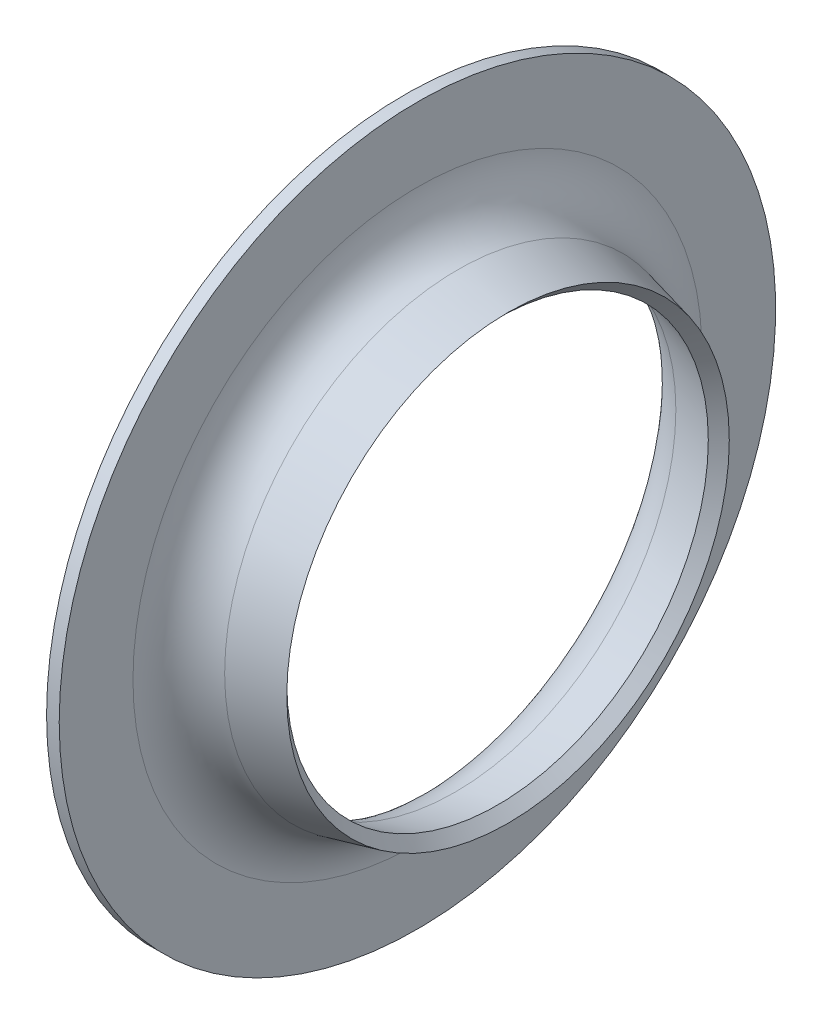
from build123d import *


with BuildPart() as part:
    # 草图1 → 旋转1 (revolve)
    with BuildSketch(Plane.XY, mode=Mode.PRIVATE) as revolve_1_sk:
        with BuildLine():
            Line((-4.3, 17), (-4.3, 13.5))
            ThreePointArc((-4.3, 13.5), (-3.762314929, 11.951026107), (-2.380543903, 11.068340325))
            Line((-2.380543903, 11.068340325), (0, 10.5))
            Line((0, 10.5), (-0.49797431, 10.00202569))
            Line((-0.49797431, 10.00202569), (-2.51987444, 10.484742003))
            ThreePointArc((-2.51987444, 10.484742003), (-4.233270511, 11.579272373), (-4.9, 13.5))
            Line((-4.9, 13.5), (-4.9, 17))
            Line((-4.9, 17), (-4.3, 17))
        make_face()
    revolve(revolve_1_sk.sketch.rotate(Axis((-48.745596361, 0, 0), (1, 0, 0)), 90), axis=Axis((-48.745596361, 0, 0), (1, 0, 0)))


solid = part.part
